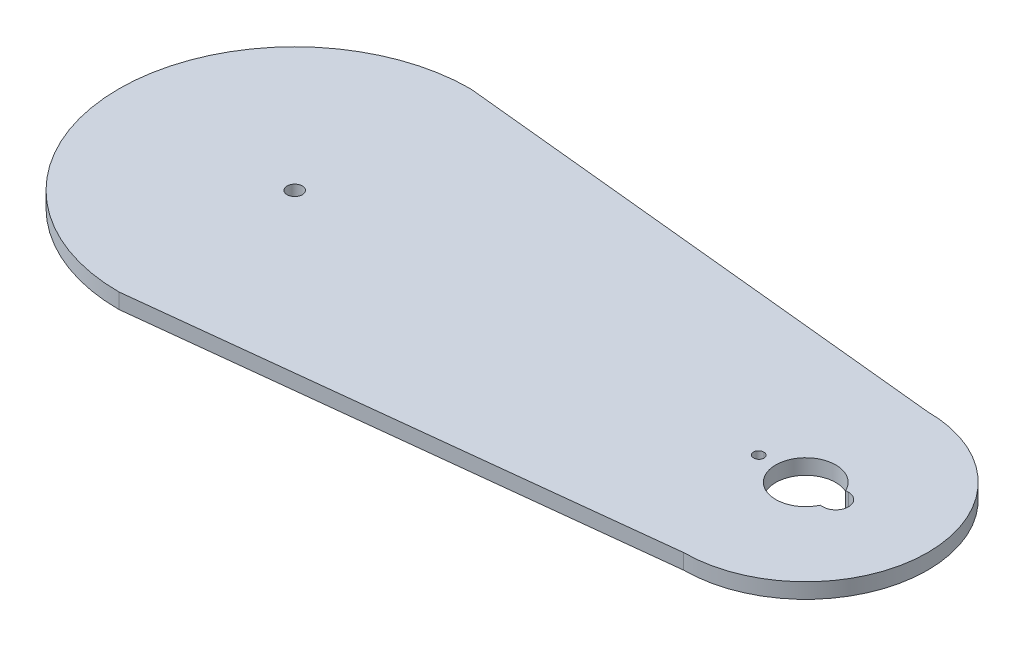
from build123d import *

# Parameters (mm, degrees)
BOSS_EXTRUDE2_DEPTH = 3
CUT_EXTRUDE4_DEPTH  = 10
SKETCH8_R           = 1
CUT_EXTRUDE5_DEPTH  = 10
SKETCH6_R           = 1.5
CUT_EXTRUDE6_DEPTH  = 10
CUT_EXTRUDE2_DEPTH  = 3
SKETCH5_R           = 1
CUT_EXTRUDE3_DEPTH  = 3


with BuildPart() as part:
    # Sketch2 → Boss-Extrude2 (new body)
    with BuildSketch(Plane(origin=(0, 0, 0), x_dir=(1, 0, 0), z_dir=(0, 1, 0))):
        with BuildLine():
            Line((-100, 58.061579531), (0, 48))
            ThreePointArc((0, 48), (24, 24), (0, 0))
            Line((0, 0), (-100, -11.145771569))
            ThreePointArc((-100, -11.145771569), (-134.60367555, 23.457903981), (-100, 58.061579531))
        make_face()
    extrude(amount=BOSS_EXTRUDE2_DEPTH)

    # Sketch7 → Cut-Extrude4 (cut)
    with BuildSketch(Plane(origin=(0, 3, 0), x_dir=(1, 0, 0), z_dir=(0, 1, 0))):
        with BuildLine():
            Line((5.344155686, 26.5), (5.904155686, 26.5))
            ThreePointArc((5.904155686, 26.5), (8.404155686, 24), (5.904155686, 21.5))
            Line((5.904155686, 21.5), (5.344155686, 21.5))
            ThreePointArc((5.344155686, 21.5), (-5.9, 24), (5.344155686, 26.5))
        make_face()
    extrude(amount=-CUT_EXTRUDE4_DEPTH, mode=Mode.SUBTRACT)

    # Sketch8 → Cut-Extrude5 (cut)
    with BuildSketch(Plane(origin=(0, 3, 0), x_dir=(1, 0, 0), z_dir=(0, 1, 0))):
        with Locations(Location((-9.2, 24, 0), (0, 0, 270))):
            Circle(SKETCH8_R)
    extrude(amount=-CUT_EXTRUDE5_DEPTH, mode=Mode.SUBTRACT)

    # Sketch6 → Cut-Extrude6 (cut)
    with BuildSketch(Plane(origin=(0, 3, 0), x_dir=(1, 0, 0), z_dir=(0, 1, 0))):
        with Locations(Location((-100, 23.457903981, 0), (0, 0, 270))):
            Circle(SKETCH6_R)
    extrude(amount=-CUT_EXTRUDE6_DEPTH, mode=Mode.SUBTRACT)

    # Sketch3 → Cut-Extrude2 (cut)
    with BuildSketch(Plane(origin=(0, 3, 0), x_dir=(1, 0, 0), z_dir=(0, 1, 0))):
        with BuildLine():
            Line((5.344155686, 26.5), (5.9, 26.5))
            ThreePointArc((5.9, 26.5), (8.4, 24), (5.9, 21.5))
            Line((5.9, 21.5), (5.344155686, 21.5))
            ThreePointArc((5.344155686, 21.5), (-5.9, 24), (5.344155686, 26.5))
        make_face()
    extrude(amount=-CUT_EXTRUDE2_DEPTH, mode=Mode.SUBTRACT)

    # Sketch5 → Cut-Extrude3 (cut)
    with BuildSketch(Plane(origin=(0, 3, 0), x_dir=(1, 0, 0), z_dir=(0, 1, 0))):
        with Locations((-9.3, 24)):
            Circle(SKETCH5_R)
    extrude(amount=-CUT_EXTRUDE3_DEPTH, mode=Mode.SUBTRACT)


solid = part.part
